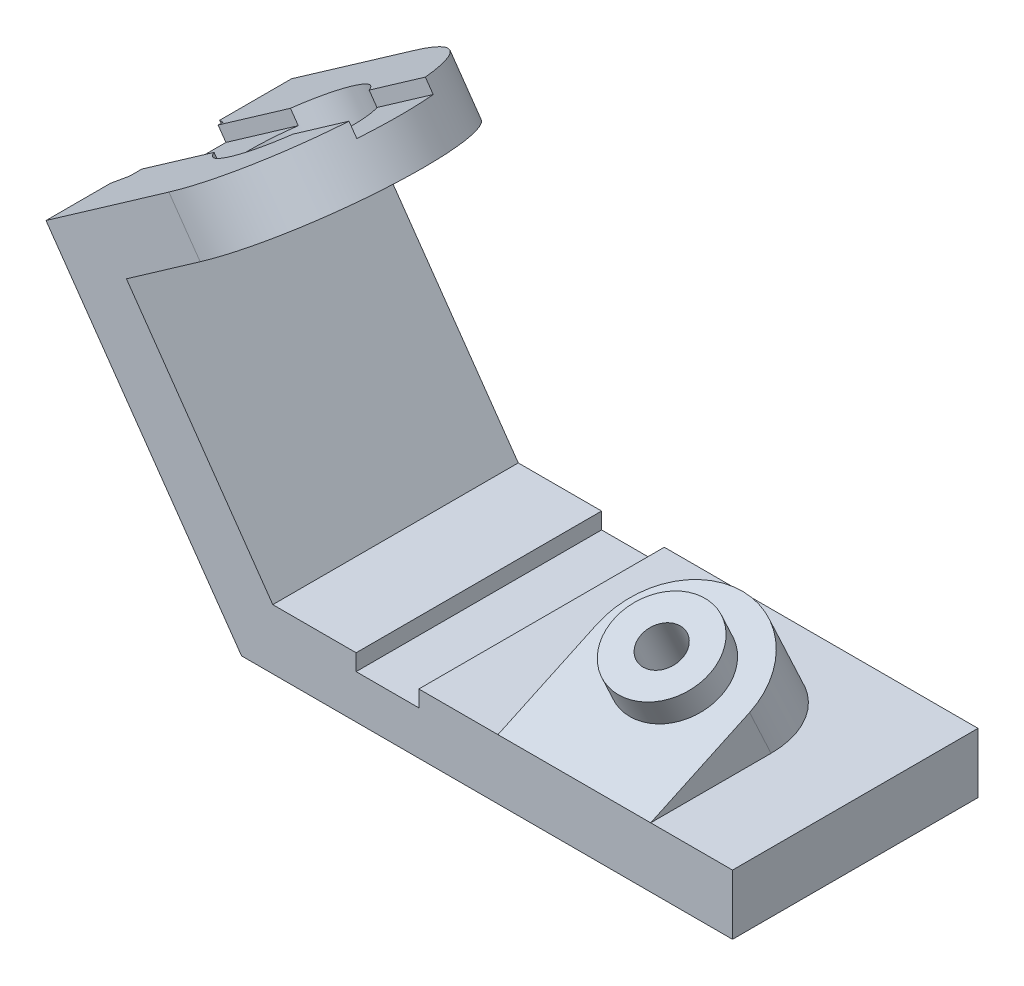
from build123d import *

# Parameters (mm, degrees)
SKETCH1_W           = 180
SKETCH1_H           = 90
BOSS_EXTRUDE1_DEPTH = 22
SKETCH2_W           = 23
SKETCH2_H           = 90
CUT_EXTRUDE1_DEPTH  = 6
BOSS_EXTRUDE2_REACH = 116.562
SKETCH4_R           = 17.5
SKETCH4_R_2         = 7.5
BOSS_EXTRUDE3_DEPTH = 10
SKETCH5_R           = 7.5
CUT_EXTRUDE2_DEPTH  = 115.561578352
SKETCH6_W           = 90
SKETCH6_H           = 125
BOSS_EXTRUDE4_DEPTH = 22
CUT_EXTRUDE3_DEPTH  = 245.0397404
SKETCH9_R           = 22.5
BOSS_EXTRUDE5_DEPTH = 20
BOSS_EXTRUDE6_START = -12
SKETCH9_3_R         = 22.5
SKETCH9_3_R_2       = 11
BOSS_EXTRUDE6_DEPTH = 8
CUT_EXTRUDE4_DEPTH  = 5


with BuildPart() as part:
    # Sketch1 → Boss-Extrude1 (new body)
    with BuildSketch(Plane(origin=(0, 0, 0), x_dir=(1, 0, 0), z_dir=(0, 1, 0))):
        Rectangle(SKETCH1_W, SKETCH1_H)
    extrude(amount=BOSS_EXTRUDE1_DEPTH)

    # Sketch2 → Cut-Extrude1 (cut)
    with BuildSketch(Plane(origin=(0, 22, 0), x_dir=(1, 0, 0), z_dir=(0, 1, 0))):
        with Locations((-36.5, 0)):
            Rectangle(SKETCH2_W, SKETCH2_H)
    extrude(amount=-CUT_EXTRUDE1_DEPTH, mode=Mode.SUBTRACT)

    # Boss-Extrude2: up to this face of the body (flat: up to its plane)
    boss_extrude2_end = Plane(part.part.faces().sort_by_distance((32.5, 22, 0))[0])
    # Sketch3 → Boss-Extrude2 (add, up to the picked face)
    with BuildSketch(Plane(origin=(0, 35.306663677, 16.463767656), x_dir=(1, 0, 0), z_dir=(0, 0.9063077870366496, 0.4226182617407003)), mode=Mode.PRIVATE) as boss_extrude2_sk1:
        with BuildLine():
            Line((4, -31.486248658), (4, 8.513751342))
            ThreePointArc((4, 8.513751342), (32, 36.513751342), (60, 8.513751342))
            Line((60, 8.513751342), (60, -31.486248658))
            Line((60, -31.486248658), (4, -31.486248658))
        make_face()
    boss_extrude2_tool1 = split(extrude(boss_extrude2_sk1.sketch, amount=-BOSS_EXTRUDE2_REACH, mode=Mode.PRIVATE), bisect_by=boss_extrude2_end, keep=Keep.BOTH, mode=Mode.PRIVATE)
    add(boss_extrude2_tool1.solids().sort_by(Axis((32, 35.232426, 16.622971), (0, -0.9063077870366496, -0.4226182617407003)))[0])

    # Sketch4 → Boss-Extrude3 (add)
    with BuildSketch(Plane(origin=(0, 44.369741547, 20.689950274), x_dir=(1, 0, 0), z_dir=(0, 0.9063077870366496, 0.4226182617407003))):
        with Locations(Location((32, 8.513751342, 0), (0, 0, 270))):
            Circle(SKETCH4_R)
        with Locations(Location((32, 8.513751342, 0), (0, 0, 270))):
            Circle(SKETCH4_R_2, mode=Mode.SUBTRACT)
    extrude(amount=-BOSS_EXTRUDE3_DEPTH)

    # Sketch5 → Cut-Extrude2 (cut, through all)
    with BuildSketch(Plane(origin=(0, 35.306663677, 16.463767656), x_dir=(1, 0, 0), z_dir=(0, 0.9063077870366496, 0.42261826174070033))):
        with Locations(Location((32, 8.513751342, 0), (0, 0, 270))):
            Circle(SKETCH5_R)
    extrude(amount=-CUT_EXTRUDE2_DEPTH, mode=Mode.SUBTRACT)

    # Sketch6 → Boss-Extrude4 (add)
    with BuildSketch(Plane(origin=(-60.39090645, -42.286167935, 0), x_dir=(0, 0, 1), z_dir=(-0.8191520442889891, -0.5735764363510502, 0))):
        with Locations((0, 114.121879272)):
            Rectangle(SKETCH6_W, SKETCH6_H)
    extrude(amount=-BOSS_EXTRUDE4_DEPTH)

    # Sketch8 → Cut-Extrude3 (cut, through all)
    with BuildSketch(Plane(origin=(-101.306148094, 144.680173471, 0), x_dir=(0.8191520442889889, 0.5735764363510504, 0), z_dir=(-0.5735764363510503, 0.8191520442889889, 0))):
        Polygon((-73.723683986, 18.662115607), (-68.723683986, 15.775364262), (-68.723683986, -18.451133047), (-73.723683986, -21.337884393), align=None)
    extrude(amount=-CUT_EXTRUDE3_DEPTH, mode=Mode.SUBTRACT)

    # Sketch9 → Boss-Extrude5 (add)
    with BuildSketch(Plane(origin=(-101.306148094, 144.680173471, 0), x_dir=(0, 0, -1), z_dir=(-0.5735764363510415, 0.819152044288995, 0))):
        with BuildLine():
            ThreePointArc((45, 18.723683986), (0, -26.276316014), (-45, 18.723683986))
            Line((-45, 18.723683986), (-45, 73.723683986))
            Line((-45, 73.723683986), (-21.337884393, 73.723683986))
            Line((-21.337884393, 73.723683986), (-18.451133047, 68.723683986))
            Line((-18.451133047, 68.723683986), (15.775364262, 68.723683986))
            Line((15.775364262, 68.723683986), (18.662115607, 73.723683986))
            Line((18.662115607, 73.723683986), (45, 73.723683986))
            Line((45, 73.723683986), (45, 18.723683986))
        make_face()
        with Locations(Location((0, 18.723683986, 0), (0, 0, 90))):
            Circle(SKETCH9_R, mode=Mode.SUBTRACT)
    extrude(amount=-BOSS_EXTRUDE5_DEPTH)

    # Sketch9<3> → Boss-Extrude6 (add)
    with BuildSketch(Plane(origin=(-101.306148094, 144.680173471, 0), x_dir=(0, 0, -1), z_dir=(-0.5735764363510415, 0.819152044288995, 0)).offset(BOSS_EXTRUDE6_START)):
        with Locations(Location((0, 18.723683986, 0), (0, 0, 90))):
            Circle(SKETCH9_3_R)
        with Locations(Location((0, 18.723683986, 0), (0, 0, 90))):
            Circle(SKETCH9_3_R_2, mode=Mode.SUBTRACT)
    extrude(amount=-BOSS_EXTRUDE6_DEPTH)

    # Sketch11 → Cut-Extrude4 (cut)
    with BuildSketch(Plane(origin=(-101.306148094, 144.680173471, 0), x_dir=(0.8191520442889889, 0.5735764363510504, 0), z_dir=(-0.5735764363510503, 0.8191520442889889, 0))):
        with BuildLine():
            Line((-36.33759894, 14), (-68.723683986, 14))
            Line((-68.723683986, 14), (-68.723683986, 0))
            Line((-68.723683986, 0), (-41.223683986, 0))
            ThreePointArc((-41.223683986, 0), (-39.96707221, 7.414071538), (-36.33759894, 14))
        make_face()
        with BuildLine():
            Line((-41.223683986, 0), (-68.723683986, 0))
            Line((-68.723683986, 0), (-68.723683986, -14))
            Line((-68.723683986, -14), (-36.33759894, -14))
            ThreePointArc((-36.33759894, -14), (-39.96707221, -7.414071538), (-41.223683986, 0))
        make_face()
        with BuildLine():
            Line((24.043125575, 14), (-1.109769032, 14))
            ThreePointArc((-1.109769032, 14), (2.519704238, 7.414071538), (3.776316014, 0))
            ThreePointArc((3.776316014, 0), (2.519704238, -7.414071538), (-1.109769032, -14))
            Line((-1.109769032, -14), (24.043125575, -14))
            ThreePointArc((24.043125575, -14), (26.276316014, 0), (24.043125575, 14))
        make_face()
    extrude(amount=-CUT_EXTRUDE4_DEPTH, mode=Mode.SUBTRACT)


solid = part.part
